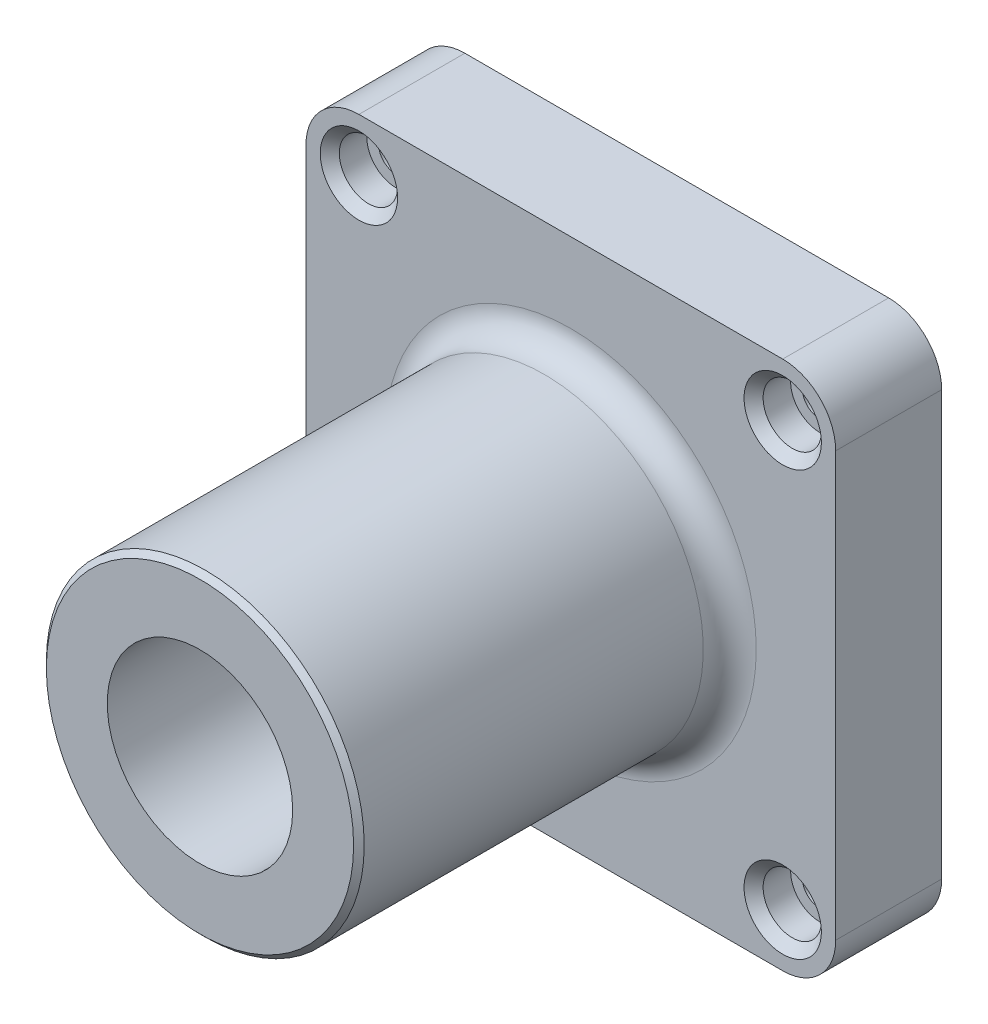
from build123d import *

# Parameters (mm, degrees)
SKETCH1_W                              = 100
SKETCH1_H                              = 100
BOSS_EXTRUDE1_DEPTH                    = 20
SKETCH2_R                              = 30
BOSS_EXTRUDE2_DEPTH                    = 70
FILLET1_R                              = 5
CHAMFER1_SIZE                          = 1
FILLET2_R                              = 10
CBORE_FOR_M6_HEX_HEAD_BOLT4_AT_2_COUNT = 2
CBORE_FOR_M6_HEX_HEAD_BOLT4_AT_2_PITCH = 80
CBORE_FOR_M6_HEX_HEAD_BOLT4_AT_3_COUNT = 2
CBORE_FOR_M6_HEX_HEAD_BOLT4_AT_3_PITCH = 113.13708499
CBORE_FOR_M6_HEX_HEAD_BOLT4_AT_4_COUNT = 2
CBORE_FOR_M6_HEX_HEAD_BOLT4_AT_4_PITCH = 80
SKETCH4_R                              = 17.5
CUT_EXTRUDE1_DEPTH                     = 40
SKETCH16_R                             = 22.5
CUT_EXTRUDE2_DEPTH                     = 50


with BuildPart() as part:
    # Sketch1 → Boss-Extrude1 (new body)
    with BuildSketch(Plane.XY):
        with Locations((50, 50)):
            Rectangle(SKETCH1_W, SKETCH1_H)
    extrude(amount=BOSS_EXTRUDE1_DEPTH)

    # Sketch2 → Boss-Extrude2 (add)
    with BuildSketch(Plane.XY.offset(20)):
        with Locations((50, 50)):
            Circle(SKETCH2_R)
    extrude(amount=BOSS_EXTRUDE2_DEPTH)

    # Fillet1
    fillet1_edges = [part.edges().sort_by_distance(p)[0] for p in [
        (20, 50, 20),
    ]]
    fillet(fillet1_edges, radius=FILLET1_R)

    # Chamfer1
    chamfer1_edges = [part.edges().sort_by_distance(p)[0] for p in [
        (20, 50, 90),
    ]]
    chamfer(chamfer1_edges, length=CHAMFER1_SIZE)

    # Fillet2
    fillet2_edges = [part.edges().sort_by_distance(p)[0] for p in [
        (0, 100, 10),
        (100, 100, 10),
        (100, 0, 10),
        (0, 0, 10),
    ]]
    fillet(fillet2_edges, radius=FILLET2_R)

    # Sketch15 → CBORE for M6 Hex Head Bolt4 (revolve, cut)
    with BuildSketch(Plane(origin=(10, 90, 20), x_dir=(0, -1, 0), z_dir=(1, 0, 0))):
        Polygon((0, 0), (0, 20), (3.3, 20), (3.3, 7), (5.5, 7), (5.5, 1.8), (7.3, 0), align=None)
    cbore_for_m6_hex_head_bolt4 = revolve(axis=Axis((10, 90, 26.35), (0, 0, -1)), mode=Mode.SUBTRACT)

    # CBORE for M6 Hex Head Bolt4 at 2: CBORE for M6 Hex Head Bolt4 ×2
    with Locations(*[(0, -i * CBORE_FOR_M6_HEX_HEAD_BOLT4_AT_2_PITCH, 0) for i in range(1, CBORE_FOR_M6_HEX_HEAD_BOLT4_AT_2_COUNT)]):
        add(cbore_for_m6_hex_head_bolt4, mode=Mode.SUBTRACT)

    # CBORE for M6 Hex Head Bolt4 at 3: CBORE for M6 Hex Head Bolt4 ×2
    with Locations(*[Vector(0.7071067811865476, -0.7071067811865475, 0) * (i * CBORE_FOR_M6_HEX_HEAD_BOLT4_AT_3_PITCH) for i in range(1, CBORE_FOR_M6_HEX_HEAD_BOLT4_AT_3_COUNT)]):
        add(cbore_for_m6_hex_head_bolt4, mode=Mode.SUBTRACT)

    # CBORE for M6 Hex Head Bolt4 at 4: CBORE for M6 Hex Head Bolt4 ×2
    with Locations(*[(i * CBORE_FOR_M6_HEX_HEAD_BOLT4_AT_4_PITCH, 0, 0) for i in range(1, CBORE_FOR_M6_HEX_HEAD_BOLT4_AT_4_COUNT)]):
        add(cbore_for_m6_hex_head_bolt4, mode=Mode.SUBTRACT)

    # Sketch4 → Cut-Extrude1 (cut)
    with BuildSketch(Plane.XY.offset(90)):
        with Locations((50, 50)):
            Circle(SKETCH4_R)
    extrude(amount=-CUT_EXTRUDE1_DEPTH, mode=Mode.SUBTRACT)

    # Sketch16 → Cut-Extrude2 (cut)
    with BuildSketch(Plane.XY.offset(50)):
        with Locations((50, 50)):
            Circle(SKETCH16_R)
    extrude(amount=-CUT_EXTRUDE2_DEPTH, mode=Mode.SUBTRACT)


solid = part.part
